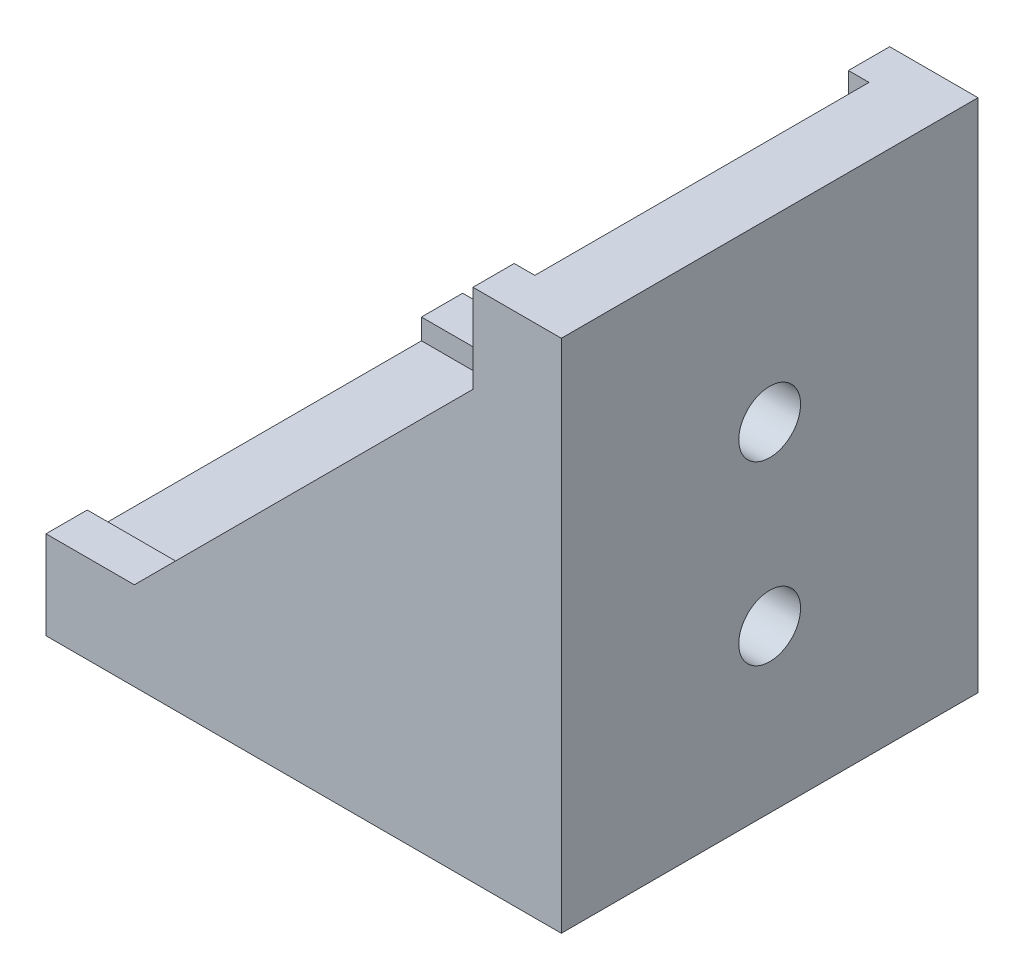
from build123d import *

# Parameters (mm, degrees)
EXTRUDE_1_DEPTH     = 14.15
SKETCH_2_W          = 30.4
SKETCH_2_H          = 30.4
CUT_EXTRUDE_1_DEPTH = 11.35
CUT_EXTRUDE_2_REACH = 53.48
SKETCH_4_R          = 2.55
CUT_EXTRUDE_3_REACH = 53.48
SKETCH_5_R          = 2.1


with BuildPart() as part:
    # 草图1 → 凸台-拉伸1 (new, symmetric)
    with BuildSketch(Plane.XY):
        Polygon((0, 0), (35, 0), (35, 35), (29, 35), (29, 29), (6, 6), (0, 6), align=None)
    extrude(amount=EXTRUDE_1_DEPTH, both=True)

    # 草图2 → 切除-拉伸1 (cut, symmetric)
    with BuildSketch(Plane.XY):
        with Locations((15.2, 19.8)):
            Rectangle(SKETCH_2_W, SKETCH_2_H)
    extrude(amount=CUT_EXTRUDE_1_DEPTH, both=True, mode=Mode.SUBTRACT)

    # 草图4 → 切除-拉伸2 (cut, up to next)
    with BuildSketch(Plane(origin=(0, 0, 0), x_dir=(1, 0, 0), z_dir=(0, 1, 0)), mode=Mode.PRIVATE) as cut_extrude_2_sk1:
        with Locations(Location((20.85, 0, 0), (0, 0, 270))):
            Circle(SKETCH_4_R)
    cut_extrude_2_tool1 = extrude(cut_extrude_2_sk1.sketch, amount=CUT_EXTRUDE_2_REACH, mode=Mode.PRIVATE) & part.part
    # 草图4 → 切除-拉伸2 (cut, up to next)
    with BuildSketch(Plane(origin=(0, 0, 0), x_dir=(1, 0, 0), z_dir=(0, 1, 0)), mode=Mode.PRIVATE) as cut_extrude_2_sk2:
        with Locations(Location((11, 0, 0), (0, 0, 270))):
            Circle(SKETCH_4_R)
    cut_extrude_2_tool2 = extrude(cut_extrude_2_sk2.sketch, amount=CUT_EXTRUDE_2_REACH, mode=Mode.PRIVATE) & part.part
    add(cut_extrude_2_tool1.solids().sort_by_distance((20.85, 0, 0))[0], mode=Mode.SUBTRACT)
    add(cut_extrude_2_tool2.solids().sort_by_distance((11, 0, 0))[0], mode=Mode.SUBTRACT)

    # 草图5 → 切除-拉伸3 (cut, up to next)
    with BuildSketch(Plane(origin=(0, 0, 0), x_dir=(0, 0, -1), z_dir=(1, 0, 0)), mode=Mode.PRIVATE) as cut_extrude_3_sk1:
        with Locations(Location((0, 23, 0), (0, 0, 180))):
            Circle(SKETCH_5_R)
    cut_extrude_3_tool1 = extrude(cut_extrude_3_sk1.sketch, amount=CUT_EXTRUDE_3_REACH, mode=Mode.PRIVATE) & part.part
    # 草图5 → 切除-拉伸3 (cut, up to next)
    with BuildSketch(Plane(origin=(0, 0, 0), x_dir=(0, 0, -1), z_dir=(1, 0, 0)), mode=Mode.PRIVATE) as cut_extrude_3_sk2:
        with Locations(Location((0, 11, 0), (0, 0, 180))):
            Circle(SKETCH_5_R)
    cut_extrude_3_tool2 = extrude(cut_extrude_3_sk2.sketch, amount=CUT_EXTRUDE_3_REACH, mode=Mode.PRIVATE) & part.part
    add(cut_extrude_3_tool1.solids().sort_by_distance((0, 23, 0))[0], mode=Mode.SUBTRACT)
    add(cut_extrude_3_tool2.solids().sort_by_distance((0, 11, 0))[0], mode=Mode.SUBTRACT)


solid = part.part
